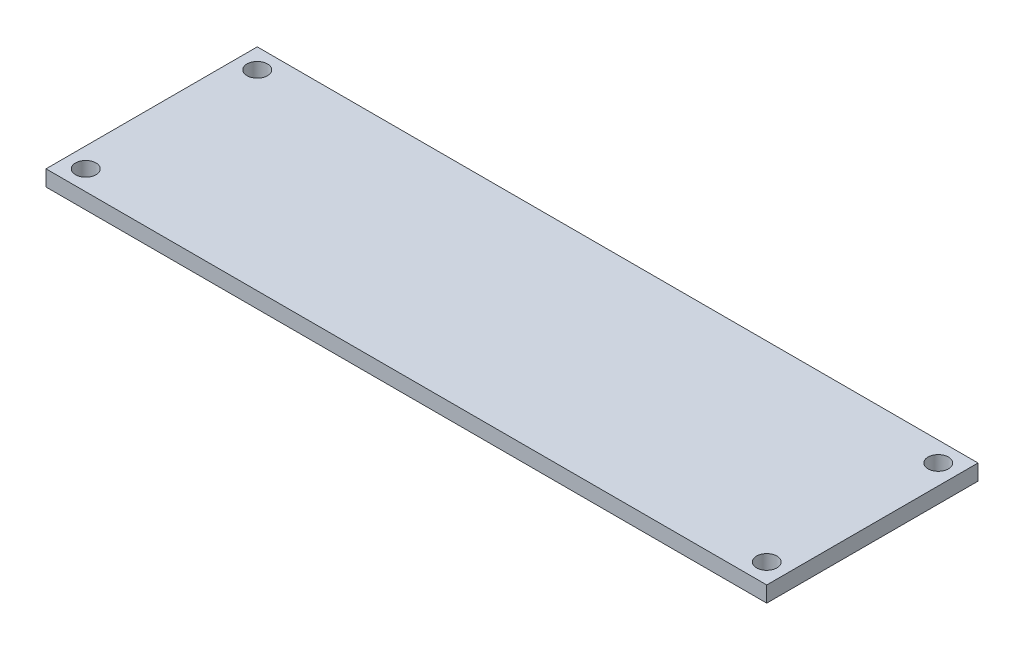
from build123d import *

# Parameters (mm, degrees)
SKETCH1_W           = 58
SKETCH1_H           = 17
SKETCH1_R           = 0.825
BOSS_EXTRUDE1_DEPTH = 1.27


with BuildPart() as part:
    # Sketch1 → Boss-Extrude1 (new body)
    with BuildSketch(Plane.XZ.offset(0.635)):
        Rectangle(SKETCH1_W, SKETCH1_H)
        with Locations(Location((27.4, -6.9, 0), (0, 0, 90))):
            Circle(SKETCH1_R, mode=Mode.SUBTRACT)
        with Locations(Location((27.4, 6.9, 0), (0, 0, 90))):
            Circle(SKETCH1_R, mode=Mode.SUBTRACT)
        with Locations(Location((-27.4, -6.9, 0), (0, 0, 90))):
            Circle(SKETCH1_R, mode=Mode.SUBTRACT)
        with Locations(Location((-27.4, 6.9, 0), (0, 0, 90))):
            Circle(SKETCH1_R, mode=Mode.SUBTRACT)
    extrude(amount=-BOSS_EXTRUDE1_DEPTH)


solid = part.part
